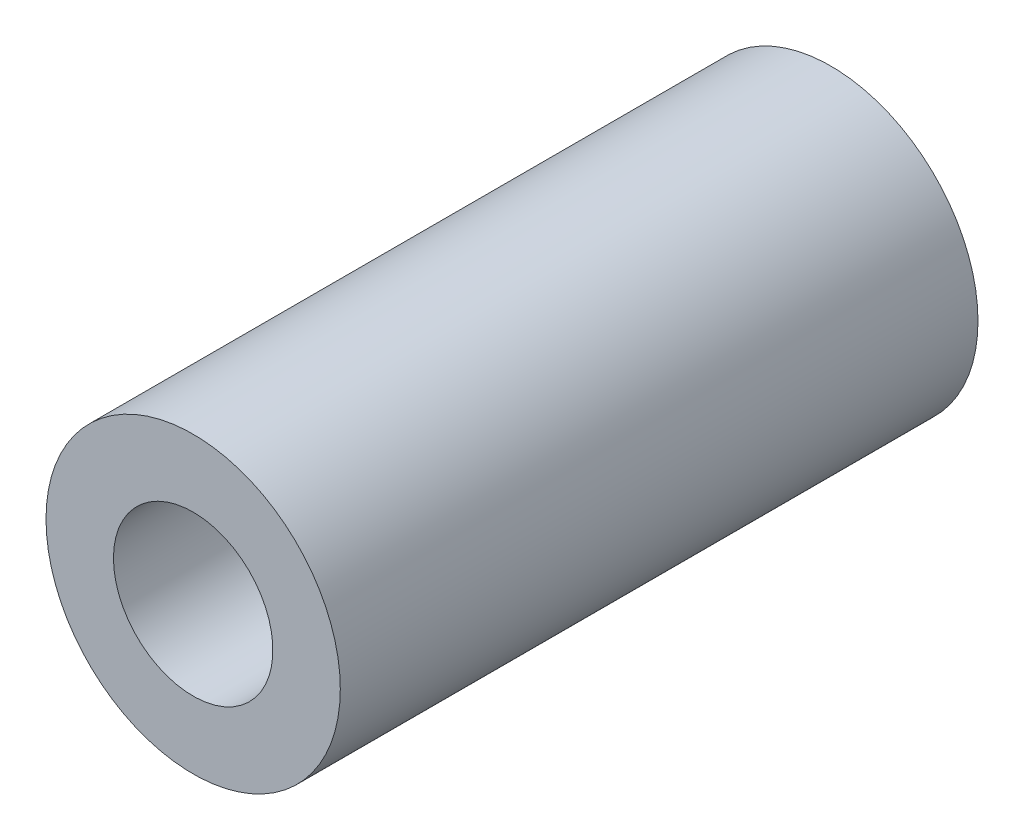
from build123d import *

# Parameters (mm, degrees)
CROQUIS1_R              = 6
CROQUIS1_R_2            = 3.25
SALIENTE_EXTRUIR1_DEPTH = 26


with BuildPart() as part:
    # Croquis1 → Saliente-Extruir1 (new body)
    with BuildSketch(Plane.XY):
        with Locations(Location((0, 0, 0), (0, 0, 180))):
            Circle(CROQUIS1_R)
        with Locations(Location((0, 0, 0), (0, 0, 180))):
            Circle(CROQUIS1_R_2, mode=Mode.SUBTRACT)
    extrude(amount=SALIENTE_EXTRUIR1_DEPTH)


solid = part.part
